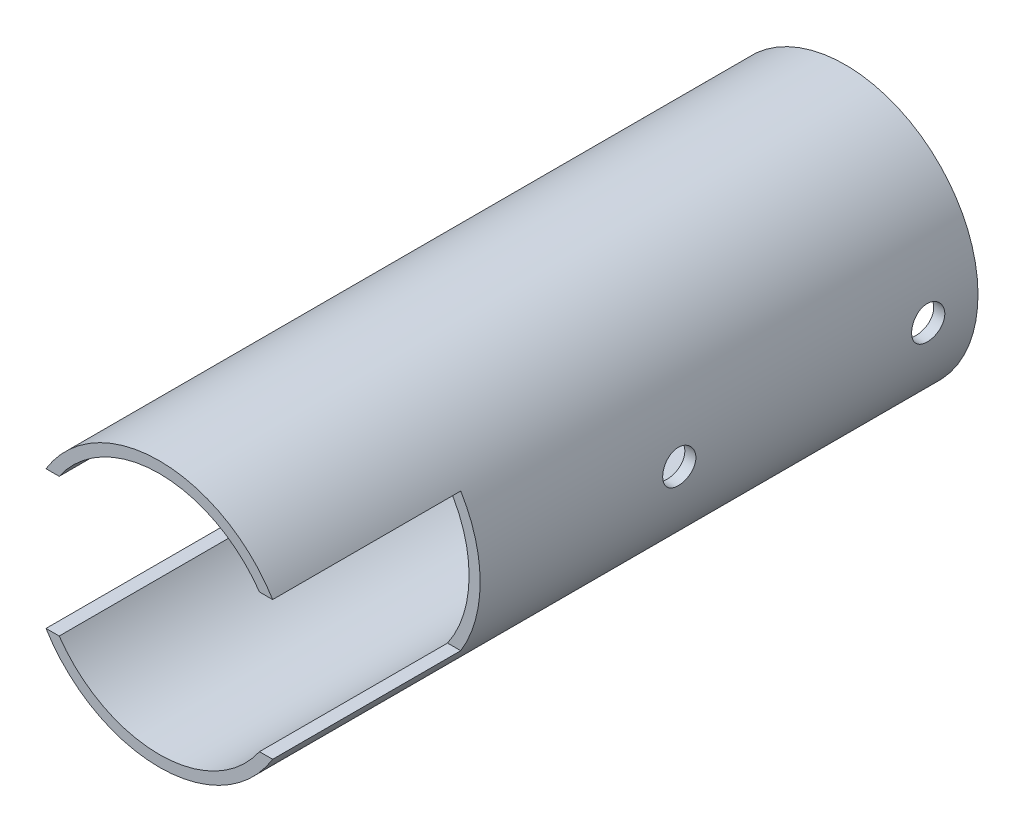
from build123d import *

# Parameters (mm, degrees)
SKETCH_1_R               = 24
SKETCH_1_R_2             = 22
EXTRUDE_1_DEPTH          = 124
SKETCH_2_R               = 3.5
CUT_EXTRUDE_1_DEPTH      = 100
CUT_EXTRUDE_2_DEPTH      = 129.561269574
CUT_EXTRUDE_2_DEPTH_BACK = 129.561269574
SKETCH_3_W               = 68
SKETCH_3_H               = 25
CUT_EXTRUDE_3_DEPTH      = 129.561269574
CUT_EXTRUDE_3_DEPTH_BACK = 129.561269574
SKETCH_4_R               = 3


with BuildPart() as part:
    # 草图1 → 凸台-拉伸1 (new body)
    with BuildSketch(Plane.XY):
        Circle(SKETCH_1_R)
        Circle(SKETCH_1_R_2, mode=Mode.SUBTRACT)
    extrude(amount=EXTRUDE_1_DEPTH)

    # 草图2 → 切除-拉伸1 (cut)
    with BuildSketch(Plane(origin=(0, 0, 0), x_dir=(1, 0, 0), z_dir=(0, 1, 0))):
        Circle(SKETCH_2_R)
    extrude(amount=-CUT_EXTRUDE_1_DEPTH, mode=Mode.SUBTRACT)

    # 草图3 → 切除-拉伸2 (cut, two sides: drawn at the far end of the back side and taken through both)
    with BuildSketch(Plane(origin=(0, 0, 0), x_dir=(0, 0, -1), z_dir=(1, 0, 0)).offset(-CUT_EXTRUDE_2_DEPTH_BACK)):
        with Locations((-124, 0)):
            Rectangle(SKETCH_3_W, SKETCH_3_H)
    extrude(amount=CUT_EXTRUDE_2_DEPTH + CUT_EXTRUDE_2_DEPTH_BACK, mode=Mode.SUBTRACT)

    # 草图4 → 切除-拉伸3 (cut, two sides: drawn at the far end of the back side and taken through both)
    with BuildSketch(Plane(origin=(0, 0, 0), x_dir=(0, 0, -1), z_dir=(1, 0, 0)).offset(-CUT_EXTRUDE_3_DEPTH_BACK)):
        with Locations((-9, 0)):
            Circle(SKETCH_4_R)
        with Locations((-54, 0)):
            Circle(SKETCH_4_R)
    extrude(amount=CUT_EXTRUDE_3_DEPTH + CUT_EXTRUDE_3_DEPTH_BACK, mode=Mode.SUBTRACT)


solid = part.part
